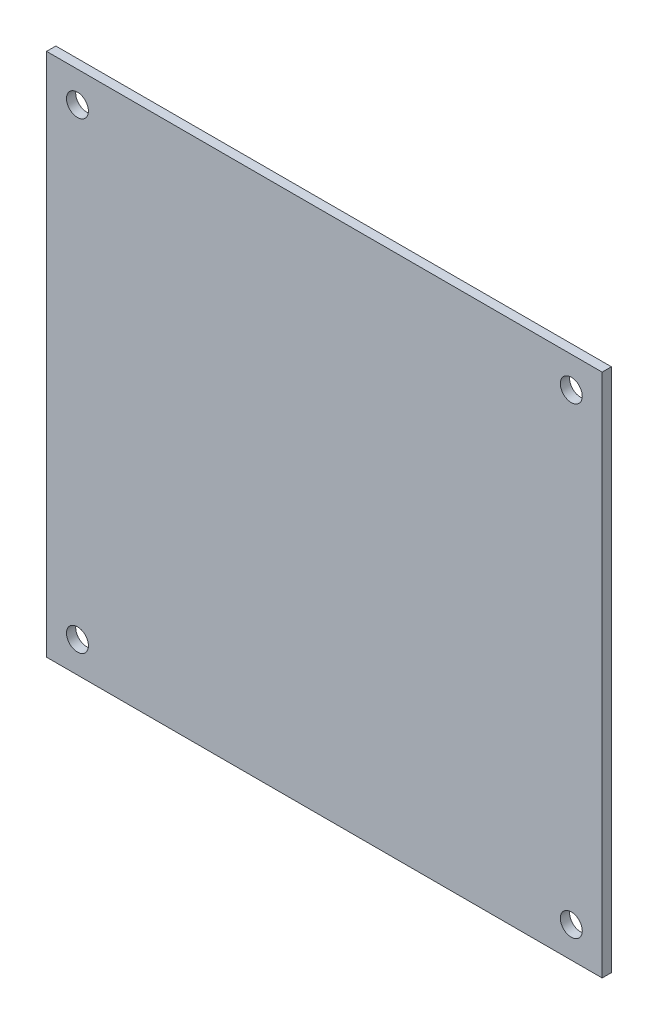
from build123d import *

# Parameters (mm, degrees)
SKETCH1_W           = 90
SKETCH1_H           = 85
SKETCH1_R           = 1.778
BOSS_EXTRUDE1_DEPTH = 1.5


with BuildPart() as part:
    # Sketch1 → Boss-Extrude1 (new body)
    with BuildSketch(Plane.XY):
        Rectangle(SKETCH1_W, SKETCH1_H)
        with Locations((-40, 37.5)):
            Circle(SKETCH1_R, mode=Mode.SUBTRACT)
        with Locations((-40, -37.5)):
            Circle(SKETCH1_R, mode=Mode.SUBTRACT)
        with Locations((40, 37.5)):
            Circle(SKETCH1_R, mode=Mode.SUBTRACT)
        with Locations((40, -37.5)):
            Circle(SKETCH1_R, mode=Mode.SUBTRACT)
    extrude(amount=BOSS_EXTRUDE1_DEPTH)


solid = part.part
